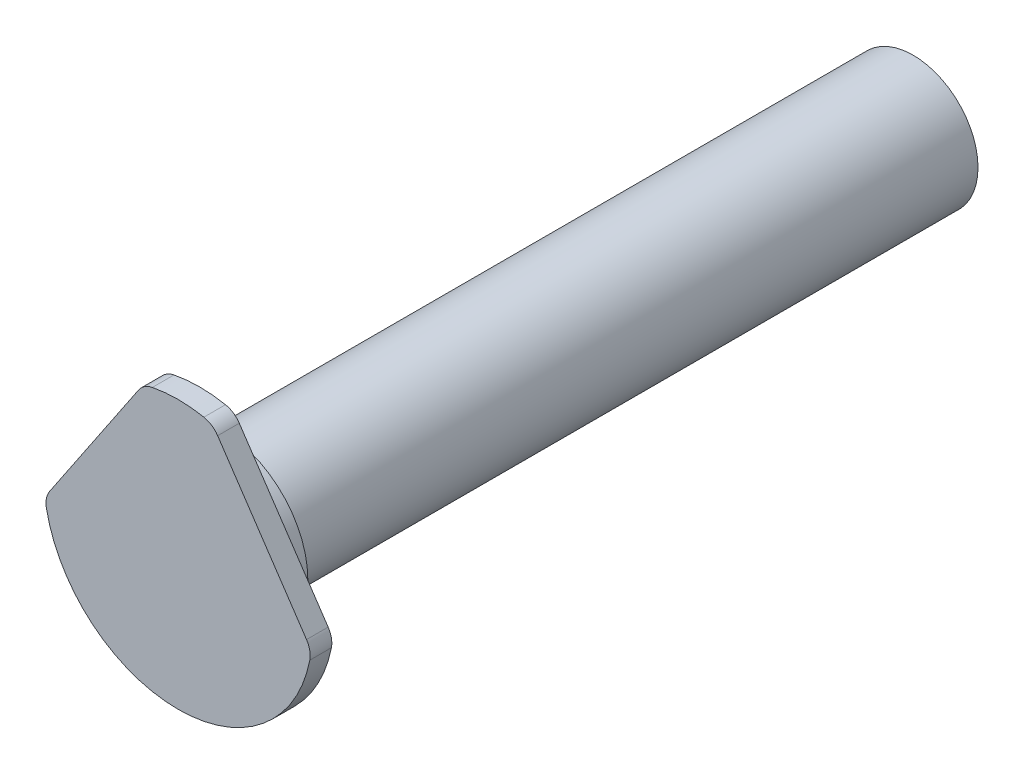
from build123d import *

# Parameters (mm, degrees)
SKETCH_1_R      = 1.5
EXTRUDE_1_DEPTH = 16
SKETCH_2_R      = 2
EXTRUDE_2_DEPTH = 0.5
EXTRUDE_3_DEPTH = 0.5


with BuildPart() as part:
    # 草圖1 → 填料-伸長1 (new body)
    with BuildSketch(Plane.XY):
        Circle(SKETCH_1_R)
    extrude(amount=-EXTRUDE_1_DEPTH)

    # 草圖2 → 填料-伸長2 (add)
    with BuildSketch(Plane.XY):
        Circle(SKETCH_2_R)
    extrude(amount=EXTRUDE_2_DEPTH)

    # 草圖3 → 填料-伸長3 (add)
    with BuildSketch(Plane.XY.offset(0.5)):
        with BuildLine():
            Line((-0.91486326, 2.834533474), (-2.970311666, -0.220914932))
            ThreePointArc((-2.970311666, -0.220914932), (-3.045533313, -0.400920314), (-3.046143975, -0.59600968))
            ThreePointArc((-3.046143975, -0.59600968), (0, -3.103904099), (3.046143975, -0.59600968))
            ThreePointArc((3.046143975, -0.59600968), (3.045533313, -0.400920314), (2.970311666, -0.220914932))
            Line((2.970311666, -0.220914932), (0.91486326, 2.834533474))
            ThreePointArc((0.91486326, 2.834533474), (0.776482443, 2.972050685), (0.59600968, 3.046143975))
            ThreePointArc((0.59600968, 3.046143975), (0.299400973, 3.089430321), (0, 3.103904099))
            ThreePointArc((0, 3.103904099), (-0.299400973, 3.089430321), (-0.59600968, 3.046143975))
            ThreePointArc((-0.59600968, 3.046143975), (-0.776482443, 2.972050685), (-0.91486326, 2.834533474))
        make_face()
    extrude(amount=EXTRUDE_3_DEPTH)


solid = part.part
